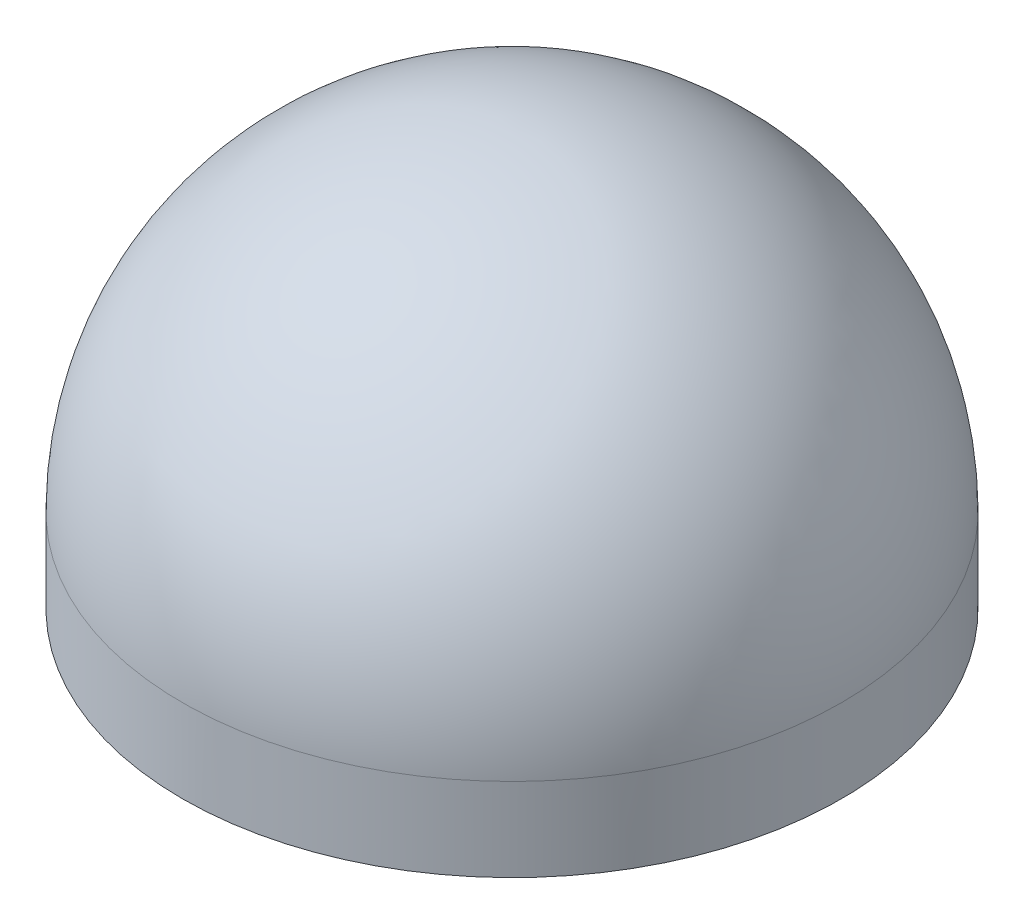
from build123d import *


with BuildPart() as part:
    # Sketch1 → HMR_topu_220g_D95x59.5 (revolve)
    with BuildSketch(Plane.XY, mode=Mode.PRIVATE) as hmr_topu_220g_d95x59_5_sk:
        with BuildLine():
            Line((0, 0), (47.5, 0))
            Line((47.5, 0), (47.5, 12))
            ThreePointArc((47.5, 12), (33.587572106, 45.587572106), (0, 59.5))
            Line((0, 59.5), (0, 0))
        make_face()
    revolve(hmr_topu_220g_d95x59_5_sk.sketch.rotate(Axis((0, 0, 0), (0, 1, 0)), 90), axis=Axis((0, 0, 0), (0, 1, 0)))


solid = part.part
